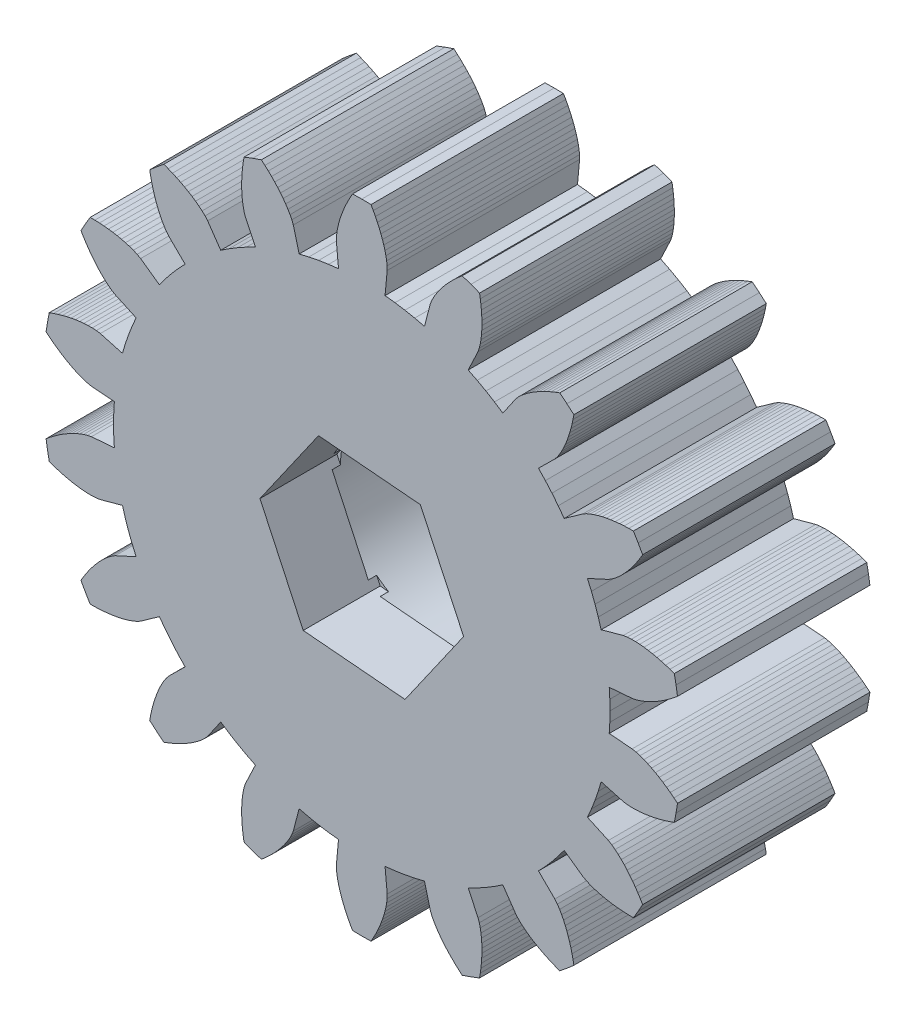
from build123d import *

# Parameters (mm, degrees)
M1_START                     = 40.4
M1_Z18_PINION_PROFILE_DEPTH  = 6
SERVO_START                  = 40.3
SERVO_SHAFT_SOCKET_PROFILE_R = 3.065
SERVO_SHAFT_SOCKET_DEPTH     = 3.96
CUT_EXTRUDE_2_DEPTH          = 2.4


with BuildPart() as part:
    # M1 Z18 pinion profile profile → M1 Z18 pinion profile (new body)
    with BuildSketch(Plane.XY.offset(M1_START)):
        Polygon((1.344036895, 7.622412008), (1.035479638, 7.670422538), (0.725236914, 7.705947795), (0.792441601, 8.420025906), (0.789820807, 8.545207433), (0.775046632, 8.671460435), (0.752028592, 8.798344278), (0.722092453, 8.925661127), (0.685971625, 9.053268544), (0.644140639, 9.181048138), (0.596934097, 9.30889439), (0.544601474, 9.436709524), (0.487336349, 9.564400784), (0.4252936, 9.691878838), (0.358600244, 9.819056789), (0.287362645, 9.945849522), (0, 9.95), (-0.287362645, 9.945849522), (-0.358600244, 9.819056789), (-0.4252936, 9.691878838), (-0.487336349, 9.564400784), (-0.544601474, 9.436709524), (-0.596934097, 9.30889439), (-0.644140639, 9.181048138), (-0.685971625, 9.053268544), (-0.722092453, 8.925661127), (-0.752028592, 8.798344278), (-0.775046632, 8.671460435), (-0.789820807, 8.545207433), (-0.792441601, 8.420025906), (-0.725236914, 7.705947795), (-1.035479638, 7.670422538), (-1.344036895, 7.622412008), (-1.650406441, 7.561994352), (-1.954089593, 7.489267912), (-2.135166943, 8.1832672), (-2.180444287, 8.300002994), (-2.23750854, 8.413588942), (-2.302535252, 8.52494812), (-2.374210948, 8.634348061), (-2.451797731, 8.741905759), (-2.534809195, 8.84767226), (-2.622894827, 8.951662852), (-2.715786758, 9.053870979), (-2.813271356, 9.154275687), (-2.915172531, 9.252846004), (-3.021341207, 9.349543715), (-3.131648322, 9.444325216), (-3.403100426, 9.349941577), (-3.671713436, 9.24775759), (-3.695289213, 9.104246701), (-3.714463047, 8.961928047), (-3.729164098, 8.820917991), (-3.73930273, 8.68134163), (-3.74476396, 8.543335881), (-3.745397605, 8.407054113), (-3.741002679, 8.272673532), (-3.731300847, 8.140407732), (-3.71588669, 8.010530266), (-3.694119741, 7.883425822), (-3.664821856, 7.759733742), (-3.624469992, 7.641205221), (-3.317089146, 6.993176646), (-3.596471591, 6.853684563), (-3.87, 6.703036625), (-4.137229146, 6.541478044), (-4.397724055, 6.36927179), (-4.805242841, 6.959485698), (-4.88771562, 7.053695698), (-4.98018716, 7.140914451), (-5.079379364, 7.223317404), (-5.18414947, 7.301605189), (-5.293844096, 7.376140122), (-5.40802363, 7.44713653), (-5.526363926, 7.514728661), (-5.648611026, 7.579001972), (-5.774557016, 7.640009839), (-5.904025832, 7.697783384), (-6.036864319, 7.752337684), (-6.172936283, 7.803675906), (-6.395736716, 7.622142209), (-6.613201398, 7.43424961), (-6.586271767, 7.291330096), (-6.555613431, 7.15103647), (-6.52119962, 7.013502305), (-6.482988891, 6.878875813), (-6.440920022, 6.747324977), (-6.394904344, 6.619045287), (-6.344813599, 6.494271999), (-6.290459292, 6.373301026), (-6.231554012, 6.256528082), (-6.167627491, 6.144533708), (-6.097791301, 6.038321641), (-6.01933381, 5.940742414), (-5.508851472, 5.436925185), (-5.723675992, 5.21029108), (-5.92918399, 4.975176099), (-6.125040957, 4.731962941), (-6.310928094, 4.481047489), (-6.895735535, 4.89628751), (-7.005456314, 4.9566086), (-7.122181708, 5.00694029), (-7.24357536, 5.050448004), (-7.368803055, 5.088180972), (-7.497374734, 5.120703126), (-7.628950602, 5.148366226), (-7.763271974, 5.171407288), (-7.900129439, 5.189993474), (-8.039345876, 5.20424605), (-8.180766484, 5.214254481), (-8.324252499, 5.220085316), (-8.469677025, 5.221788112), (-8.616952768, 4.975), (-8.757039671, 4.72406141), (-8.682852743, 4.598971473), (-8.606060084, 4.477624357), (-8.526682225, 4.360154733), (-8.444730913, 4.246716051), (-8.360206072, 4.137487102), (-8.273091241, 4.032681912), (-8.183346359, 3.932565419), (-8.090895508, 3.837480155), (-7.995603952, 3.747896274), (-7.89722834, 3.664520145), (-7.795277121, 3.588598833), (-7.688177135, 3.523738396), (-7.036165008, 3.224900306), (-7.160520595, 2.938459597), (-7.273220885, 2.647235909), (-7.374082433, 2.351703272), (-7.462941064, 2.052342728), (-8.154500753, 2.242524787), (-8.278235587, 2.261681353), (-8.405136031, 2.269055234), (-8.534089264, 2.268420039), (-8.66467024, 2.261047035), (-8.79661133, 2.247633759), (-8.929713539, 2.228626974), (-9.063814849, 2.204337874), (-9.198775649, 2.174995166), (-9.334470976, 2.140773382), (-9.470785962, 2.101809533), (-9.607612974, 2.058213618), (-9.74484972, 2.010075606), (-9.798837142, 1.727799368), (-9.844649719, 1.444081684), (-9.732153532, 1.351909017), (-9.618488879, 1.264144663), (-9.503721114, 1.180908152), (-9.387913756, 1.102339658), (-9.271127886, 1.02860722), (-9.153421236, 0.959917583), (-9.034846775, 0.89653341), (-8.915450317, 0.838802543), (-8.795266053, 0.787212862), (-8.674306901, 0.74251137), (-8.552537475, 0.706038044), (-8.429712833, 0.681719522), (-7.714813201, 0.623904856), (-7.733700737, 0.31220652), (-7.74, 0), (-7.733700737, -0.31220652), (-7.714813201, -0.623904856), (-8.429712833, -0.681719522), (-8.552537475, -0.706038044), (-8.674306901, -0.74251137), (-8.795266053, -0.787212862), (-8.915450317, -0.838802543), (-9.034846775, -0.89653341), (-9.153421236, -0.959917583), (-9.271127886, -1.02860722), (-9.387913756, -1.102339658), (-9.503721114, -1.180908152), (-9.618488879, -1.264144663), (-9.732153532, -1.351909017), (-9.844649719, -1.444081684), (-9.798837142, -1.727799368), (-9.74484972, -2.010075606), (-9.607612974, -2.058213618), (-9.470785962, -2.101809533), (-9.334470976, -2.140773382), (-9.198775649, -2.174995166), (-9.063814849, -2.204337874), (-8.929713539, -2.228626974), (-8.79661133, -2.247633759), (-8.66467024, -2.261047035), (-8.534089264, -2.268420039), (-8.405136031, -2.269055234), (-8.278235587, -2.261681353), (-8.154500753, -2.242524787), (-7.462941064, -2.052342728), (-7.374082433, -2.351703272), (-7.273220885, -2.647235909), (-7.160520595, -2.938459597), (-7.036165008, -3.224900306), (-7.688177135, -3.523738396), (-7.795277121, -3.588598833), (-7.89722834, -3.664520145), (-7.995603952, -3.747896274), (-8.090895508, -3.837480155), (-8.183346359, -3.932565419), (-8.273091241, -4.032681912), (-8.360206072, -4.137487102), (-8.444730913, -4.246716051), (-8.526682225, -4.360154733), (-8.606060084, -4.477624357), (-8.682852743, -4.598971473), (-8.757039671, -4.72406141), (-8.616952768, -4.975), (-8.469677025, -5.221788112), (-8.324252499, -5.220085316), (-8.180766484, -5.214254481), (-8.039345876, -5.20424605), (-7.900129439, -5.189993474), (-7.763271974, -5.171407288), (-7.628950602, -5.148366226), (-7.497374734, -5.120703126), (-7.368803055, -5.088180972), (-7.24357536, -5.050448004), (-7.122181708, -5.00694029), (-7.005456314, -4.9566086), (-6.895735535, -4.89628751), (-6.310928094, -4.481047489), (-6.125040957, -4.731962941), (-5.92918399, -4.975176099), (-5.723675992, -5.21029108), (-5.508851472, -5.436925185), (-6.01933381, -5.940742414), (-6.097791301, -6.038321641), (-6.167627491, -6.144533708), (-6.231554012, -6.256528082), (-6.290459292, -6.373301026), (-6.344813599, -6.494271999), (-6.394904344, -6.619045287), (-6.440920022, -6.747324977), (-6.482988891, -6.878875813), (-6.52119962, -7.013502305), (-6.555613431, -7.15103647), (-6.586271767, -7.291330096), (-6.613201398, -7.43424961), (-6.395736716, -7.622142209), (-6.172936283, -7.803675906), (-6.036864319, -7.752337684), (-5.904025832, -7.697783384), (-5.774557016, -7.640009839), (-5.648611026, -7.579001972), (-5.526363926, -7.514728661), (-5.40802363, -7.44713653), (-5.293844096, -7.376140122), (-5.18414947, -7.301605189), (-5.079379364, -7.223317404), (-4.98018716, -7.140914451), (-4.88771562, -7.053695698), (-4.805242841, -6.959485698), (-4.397724055, -6.36927179), (-4.137229146, -6.541478044), (-3.87, -6.703036625), (-3.596471591, -6.853684563), (-3.317089146, -6.993176646), (-3.624469992, -7.641205221), (-3.664821856, -7.759733742), (-3.694119741, -7.883425822), (-3.71588669, -8.010530266), (-3.731300847, -8.140407732), (-3.741002679, -8.272673532), (-3.745397605, -8.407054113), (-3.74476396, -8.543335881), (-3.73930273, -8.68134163), (-3.729164098, -8.820917991), (-3.714463047, -8.961928047), (-3.695289213, -9.104246701), (-3.671713436, -9.24775759), (-3.403100426, -9.349941577), (-3.131648322, -9.444325216), (-3.021341207, -9.349543715), (-2.915172531, -9.252846004), (-2.813271356, -9.154275687), (-2.715786758, -9.053870979), (-2.622894827, -8.951662852), (-2.534809195, -8.84767226), (-2.451797731, -8.741905759), (-2.374210948, -8.634348061), (-2.302535252, -8.52494812), (-2.23750854, -8.413588942), (-2.180444287, -8.300002994), (-2.135166943, -8.1832672), (-1.954089593, -7.489267912), (-1.650406441, -7.561994352), (-1.344036895, -7.622412008), (-1.035479638, -7.670422538), (-0.725236914, -7.705947795), (-0.792441601, -8.420025906), (-0.789820807, -8.545207433), (-0.775046632, -8.671460435), (-0.752028592, -8.798344278), (-0.722092453, -8.925661127), (-0.685971625, -9.053268544), (-0.644140639, -9.181048138), (-0.596934097, -9.30889439), (-0.544601474, -9.436709524), (-0.487336349, -9.564400784), (-0.4252936, -9.691878838), (-0.358600244, -9.819056789), (-0.287362645, -9.945849522), (0, -9.95), (0.287362645, -9.945849522), (0.358600244, -9.819056789), (0.4252936, -9.691878838), (0.487336349, -9.564400784), (0.544601474, -9.436709524), (0.596934097, -9.30889439), (0.644140639, -9.181048138), (0.685971625, -9.053268544), (0.722092453, -8.925661127), (0.752028592, -8.798344278), (0.775046632, -8.671460435), (0.789820807, -8.545207433), (0.792441601, -8.420025906), (0.725236914, -7.705947795), (1.035479638, -7.670422538), (1.344036895, -7.622412008), (1.650406441, -7.561994352), (1.954089593, -7.489267912), (2.135166943, -8.1832672), (2.180444287, -8.300002994), (2.23750854, -8.413588942), (2.302535252, -8.52494812), (2.374210948, -8.634348061), (2.451797731, -8.741905759), (2.534809195, -8.84767226), (2.622894827, -8.951662852), (2.715786758, -9.053870979), (2.813271356, -9.154275687), (2.915172531, -9.252846004), (3.021341207, -9.349543715), (3.131648322, -9.444325216), (3.403100426, -9.349941577), (3.671713436, -9.24775759), (3.695289213, -9.104246701), (3.714463047, -8.961928047), (3.729164098, -8.820917991), (3.73930273, -8.68134163), (3.74476396, -8.543335881), (3.745397605, -8.407054113), (3.741002679, -8.272673532), (3.731300847, -8.140407732), (3.71588669, -8.010530266), (3.694119741, -7.883425822), (3.664821856, -7.759733742), (3.624469992, -7.641205221), (3.317089146, -6.993176646), (3.596471591, -6.853684563), (3.87, -6.703036625), (4.137229146, -6.541478044), (4.397724055, -6.36927179), (4.805242841, -6.959485698), (4.88771562, -7.053695698), (4.98018716, -7.140914451), (5.079379364, -7.223317404), (5.18414947, -7.301605189), (5.293844096, -7.376140122), (5.40802363, -7.44713653), (5.526363926, -7.514728661), (5.648611026, -7.579001972), (5.774557016, -7.640009839), (5.904025832, -7.697783384), (6.036864319, -7.752337684), (6.172936283, -7.803675906), (6.395736716, -7.622142209), (6.613201398, -7.43424961), (6.586271767, -7.291330096), (6.555613431, -7.15103647), (6.52119962, -7.013502305), (6.482988891, -6.878875813), (6.440920022, -6.747324977), (6.394904344, -6.619045287), (6.344813599, -6.494271999), (6.290459292, -6.373301026), (6.231554012, -6.256528082), (6.167627491, -6.144533708), (6.097791301, -6.038321641), (6.01933381, -5.940742414), (5.508851472, -5.436925185), (5.723675992, -5.21029108), (5.92918399, -4.975176099), (6.125040957, -4.731962941), (6.310928094, -4.481047489), (6.895735535, -4.89628751), (7.005456314, -4.9566086), (7.122181708, -5.00694029), (7.24357536, -5.050448004), (7.368803055, -5.088180972), (7.497374734, -5.120703126), (7.628950602, -5.148366226), (7.763271974, -5.171407288), (7.900129439, -5.189993474), (8.039345876, -5.20424605), (8.180766484, -5.214254481), (8.324252499, -5.220085316), (8.469677025, -5.221788112), (8.616952768, -4.975), (8.757039671, -4.72406141), (8.682852743, -4.598971473), (8.606060084, -4.477624357), (8.526682225, -4.360154733), (8.444730913, -4.246716051), (8.360206072, -4.137487102), (8.273091241, -4.032681912), (8.183346359, -3.932565419), (8.090895508, -3.837480155), (7.995603952, -3.747896274), (7.89722834, -3.664520145), (7.795277121, -3.588598833), (7.688177135, -3.523738396), (7.036165008, -3.224900306), (7.160520595, -2.938459597), (7.273220885, -2.647235909), (7.374082433, -2.351703272), (7.462941064, -2.052342728), (8.154500753, -2.242524787), (8.278235587, -2.261681353), (8.405136031, -2.269055234), (8.534089264, -2.268420039), (8.66467024, -2.261047035), (8.79661133, -2.247633759), (8.929713539, -2.228626974), (9.063814849, -2.204337874), (9.198775649, -2.174995166), (9.334470976, -2.140773382), (9.470785962, -2.101809533), (9.607612974, -2.058213618), (9.74484972, -2.010075606), (9.798837142, -1.727799368), (9.844649719, -1.444081684), (9.732153532, -1.351909017), (9.618488879, -1.264144663), (9.503721114, -1.180908152), (9.387913756, -1.102339658), (9.271127886, -1.02860722), (9.153421236, -0.959917583), (9.034846775, -0.89653341), (8.915450317, -0.838802543), (8.795266053, -0.787212862), (8.674306901, -0.74251137), (8.552537475, -0.706038044), (8.429712833, -0.681719522), (7.714813201, -0.623904856), (7.733700737, -0.31220652), (7.74, 0), (7.733700737, 0.31220652), (7.714813201, 0.623904856), (8.429712833, 0.681719522), (8.552537475, 0.706038044), (8.674306901, 0.74251137), (8.795266053, 0.787212862), (8.915450317, 0.838802543), (9.034846775, 0.89653341), (9.153421236, 0.959917583), (9.271127886, 1.02860722), (9.387913756, 1.102339658), (9.503721114, 1.180908152), (9.618488879, 1.264144663), (9.732153532, 1.351909017), (9.844649719, 1.444081684), (9.798837142, 1.727799368), (9.74484972, 2.010075606), (9.607612974, 2.058213618), (9.470785962, 2.101809533), (9.334470976, 2.140773382), (9.198775649, 2.174995166), (9.063814849, 2.204337874), (8.929713539, 2.228626974), (8.79661133, 2.247633759), (8.66467024, 2.261047035), (8.534089264, 2.268420039), (8.405136031, 2.269055234), (8.278235587, 2.261681353), (8.154500753, 2.242524787), (7.462941064, 2.052342728), (7.374082433, 2.351703272), (7.273220885, 2.647235909), (7.160520595, 2.938459597), (7.036165008, 3.224900306), (7.688177135, 3.523738396), (7.795277121, 3.588598833), (7.89722834, 3.664520145), (7.995603952, 3.747896274), (8.090895508, 3.837480155), (8.183346359, 3.932565419), (8.273091241, 4.032681912), (8.360206072, 4.137487102), (8.444730913, 4.246716051), (8.526682225, 4.360154733), (8.606060084, 4.477624357), (8.682852743, 4.598971473), (8.757039671, 4.72406141), (8.616952768, 4.975), (8.469677025, 5.221788112), (8.324252499, 5.220085316), (8.180766484, 5.214254481), (8.039345876, 5.20424605), (7.900129439, 5.189993474), (7.763271974, 5.171407288), (7.628950602, 5.148366226), (7.497374734, 5.120703126), (7.368803055, 5.088180972), (7.24357536, 5.050448004), (7.122181708, 5.00694029), (7.005456314, 4.9566086), (6.895735535, 4.89628751), (6.310928094, 4.481047489), (6.125040957, 4.731962941), (5.92918399, 4.975176099), (5.723675992, 5.21029108), (5.508851472, 5.436925185), (6.01933381, 5.940742414), (6.097791301, 6.038321641), (6.167627491, 6.144533708), (6.231554012, 6.256528082), (6.290459292, 6.373301026), (6.344813599, 6.494271999), (6.394904344, 6.619045287), (6.440920022, 6.747324977), (6.482988891, 6.878875813), (6.52119962, 7.013502305), (6.555613431, 7.15103647), (6.586271767, 7.291330096), (6.613201398, 7.43424961), (6.395736716, 7.622142209), (6.172936283, 7.803675906), (6.036864319, 7.752337684), (5.904025832, 7.697783384), (5.774557016, 7.640009839), (5.648611026, 7.579001972), (5.526363926, 7.514728661), (5.40802363, 7.44713653), (5.293844096, 7.376140122), (5.18414947, 7.301605189), (5.079379364, 7.223317404), (4.98018716, 7.140914451), (4.88771562, 7.053695698), (4.805242841, 6.959485698), (4.397724055, 6.36927179), (4.137229146, 6.541478044), (3.87, 6.703036625), (3.596471591, 6.853684563), (3.317089146, 6.993176646), (3.624469992, 7.641205221), (3.664821856, 7.759733742), (3.694119741, 7.883425822), (3.71588669, 8.010530266), (3.731300847, 8.140407732), (3.741002679, 8.272673532), (3.745397605, 8.407054113), (3.74476396, 8.543335881), (3.73930273, 8.68134163), (3.729164098, 8.820917991), (3.714463047, 8.961928047), (3.695289213, 9.104246701), (3.671713436, 9.24775759), (3.403100426, 9.349941577), (3.131648322, 9.444325216), (3.021341207, 9.349543715), (2.915172531, 9.252846004), (2.813271356, 9.154275687), (2.715786758, 9.053870979), (2.622894827, 8.951662852), (2.534809195, 8.84767226), (2.451797731, 8.741905759), (2.374210948, 8.634348061), (2.302535252, 8.52494812), (2.23750854, 8.413588942), (2.180444287, 8.300002994), (2.135166943, 8.1832672), (1.954089593, 7.489267912), (1.650406441, 7.561994352), align=None)
    extrude(amount=M1_Z18_PINION_PROFILE_DEPTH)

    # Servo shaft socket profile → Servo shaft socket (cut)
    with BuildSketch(Plane.XY.offset(SERVO_START)):
        Circle(SERVO_SHAFT_SOCKET_PROFILE_R)
    extrude(amount=SERVO_SHAFT_SOCKET_DEPTH, mode=Mode.SUBTRACT)

    # Retaining screw bore profile → 切除-拉伸2 (cut)
    with BuildSketch(Plane.XY.offset(46.4)):
        Polygon((1.826383325, 2.611728154), (-1.348631267, 2.887558433), (-3.175014592, 0.275830279), (-1.826383325, -2.611728154), (1.348631267, -2.887558433), (3.175014592, -0.275830279), align=None)
    extrude(amount=-CUT_EXTRUDE_2_DEPTH, mode=Mode.SUBTRACT)


solid = part.part
